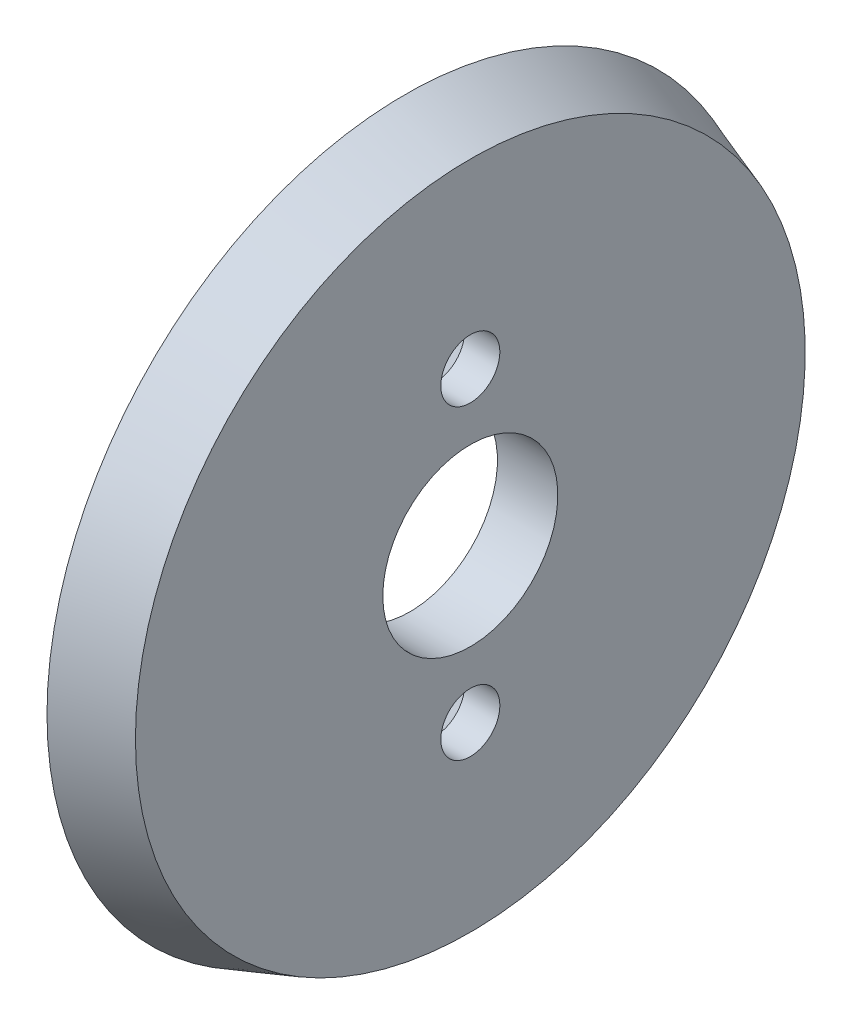
from build123d import *

# Parameters (mm, degrees)
CSK_FOR_M3_FLAT_COUNTERSUNK_HEAD_SCREW1_D           = 2.7
CSK_FOR_M3_FLAT_COUNTERSUNK_HEAD_SCREW1_CSINK_D     = 5
CSK_FOR_M3_FLAT_COUNTERSUNK_HEAD_SCREW1_CSINK_ANGLE = 90


with BuildPart() as part:
    # Sketch1 → Revolve1 (revolve)
    with BuildSketch(Plane(origin=(0, 0, 0), x_dir=(-1, 0, 0), z_dir=(0, 0, -1)), mode=Mode.PRIVATE) as revolve1_sk:
        Polygon((-9.95, 4), (-7.190575715, 4), (-7.190575715, 11.457942816), (-5.45, 12.070691824), (-6.96, 16.36), (-9.95, 15.307406012), align=None)
    revolve(revolve1_sk.sketch.rotate(Axis((15.476540881, 0, 0), (-1, 0, 0)), 270), axis=Axis((15.476540881, 0, 0), (-1, 0, 0)))

    # CSK for M3 Flat Countersunk Head Screw1 (through all)
    with Locations(Plane.ZY.offset(-7.190575715)):
        with Locations((0, 7), (0, -7)):
            CounterSinkHole(CSK_FOR_M3_FLAT_COUNTERSUNK_HEAD_SCREW1_D / 2, CSK_FOR_M3_FLAT_COUNTERSUNK_HEAD_SCREW1_CSINK_D / 2, counter_sink_angle=CSK_FOR_M3_FLAT_COUNTERSUNK_HEAD_SCREW1_CSINK_ANGLE)


solid = part.part
